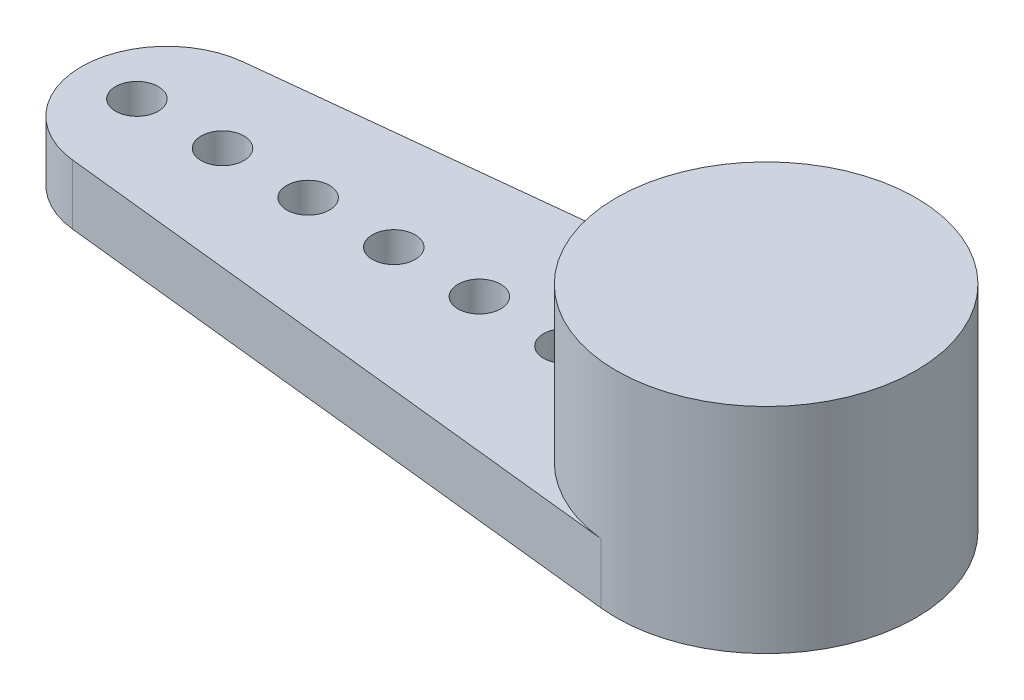
from build123d import *

# Parameters (mm, degrees)
ESBO_O1_R                = 3.5
RESSALTO_EXTRUS_O1_DEPTH = 5
RESSALTO_EXTRUS_O2_DEPTH = 1.4
ESBO_O3_R                = 0.5
CORTE_EXTRUS_O1_DEPTH    = 18.12454379
PADR_O_LINEAR1_COUNT     = 6
PADR_O_LINEAR1_PITCH     = 2


with BuildPart() as part:
    # Esboço1 → Ressalto-extrusão1 (new body)
    with BuildSketch(Plane(origin=(0, 0, 0), x_dir=(1, 0, 0), z_dir=(0, 1, 0))):
        Circle(ESBO_O1_R)
    extrude(amount=RESSALTO_EXTRUS_O1_DEPTH)

    # Esboço2 → Ressalto-extrusão2 (add)
    with BuildSketch(Plane(origin=(0, 0, 0), x_dir=(1, 0, 0), z_dir=(0, 1, 0))):
        with BuildLine():
            Line((-14.214285714, 1.988487272), (-0.375, 3.479852727))
            Line((-0.375, 3.479852727), (-0.375, -3.479852727))
            Line((-0.375, -3.479852727), (-14.214285714, -1.988487272))
            ThreePointArc((-14.214285714, -1.988487272), (-16, 0), (-14.214285714, 1.988487272))
        make_face()
    extrude(amount=RESSALTO_EXTRUS_O2_DEPTH)

    # Esboço3 → Corte-extrusão1 (cut, through all)
    with BuildSketch(Plane(origin=(0, 0, 0), x_dir=(1, 0, 0), z_dir=(0, 1, 0))):
        with Locations((-14.7, 0)):
            Circle(ESBO_O3_R)
    corte_extrus_o1 = extrude(amount=CORTE_EXTRUS_O1_DEPTH, mode=Mode.SUBTRACT)

    # Padrão linear1: Corte-extrusão1 ×6
    with Locations(*[(i * PADR_O_LINEAR1_PITCH, 0, 0) for i in range(1, PADR_O_LINEAR1_COUNT)]):
        add(corte_extrus_o1, mode=Mode.SUBTRACT)


solid = part.part
